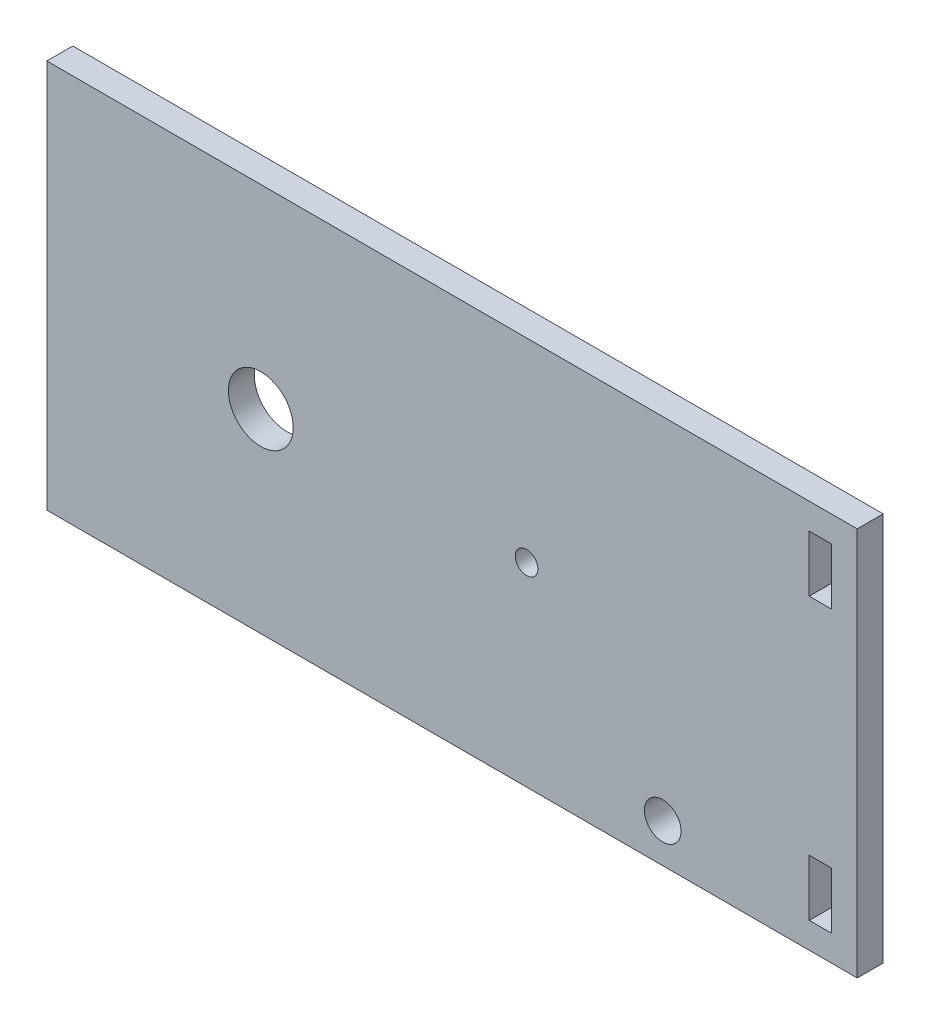
from build123d import *

# Parameters (mm, degrees)
SKETCH1_W               = 121
SKETCH1_H               = 60
SKETCH1_R               = 5
SKETCH1_R_2             = 2.83
BOSS_EXTRUDE1_DEPTH     = 4
SKETCH2_W               = 4
SKETCH2_H               = 60
BOSS_EXTRUDE2_DEPTH     = 4
CUT_EXTRUDE1_DEPTH      = 87.469647854
CUT_EXTRUDE1_DEPTH_BACK = 87.469647854
SKETCH3_R               = 1.75
SKETCH3_W               = 3.4
SKETCH3_H               = 8.7


with BuildPart() as part:
    # Sketch1 → Boss-Extrude1 (new body)
    with BuildSketch(Plane.XY):
        with Locations((-20.5, 0)):
            Rectangle(SKETCH1_W, SKETCH1_H)
        with Locations((-48, 0)):
            Circle(SKETCH1_R, mode=Mode.SUBTRACT)
        with Locations((14, -24)):
            Circle(SKETCH1_R_2, mode=Mode.SUBTRACT)
    extrude(amount=BOSS_EXTRUDE1_DEPTH)

    # Sketch2 → Boss-Extrude2 (add)
    with BuildSketch(Plane.XY):
        with Locations((42, 0)):
            Rectangle(SKETCH2_W, SKETCH2_H)
    extrude(amount=BOSS_EXTRUDE2_DEPTH)

    # Sketch3 → Cut-Extrude1 (cut, two sides: drawn at the far end of the back side and taken through both)
    with BuildSketch(Plane.XY.offset(-CUT_EXTRUDE1_DEPTH_BACK)):
        with Locations((-7, 0)):
            Circle(SKETCH3_R)
        with Locations((38.3, 21.65)):
            Rectangle(SKETCH3_W, SKETCH3_H)
        with Locations((38.3, -21.65)):
            Rectangle(SKETCH3_W, SKETCH3_H)
    extrude(amount=CUT_EXTRUDE1_DEPTH + CUT_EXTRUDE1_DEPTH_BACK, mode=Mode.SUBTRACT)


solid = part.part
